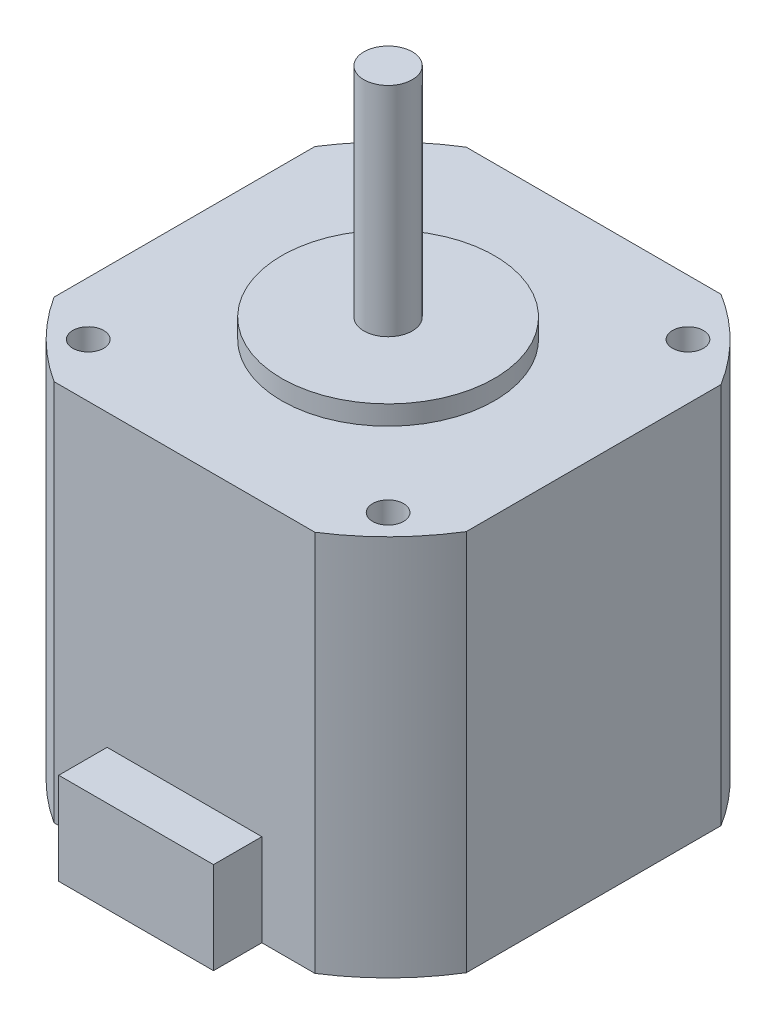
from build123d import *

# Parameters (mm, degrees)
EXTRUDE_1_DEPTH     = 39.5
SKETCH_2_R          = 11
EXTRUDE_2_DEPTH     = 2
SKETCH_3_R          = 2.5
EXTRUDE_3_DEPTH     = 22.5
SKETCH_4_W          = 16
SKETCH_4_H          = 5
EXTRUDE_4_DEPTH     = 9.5
SKETCH_5_R          = 1.6
CUT_EXTRUDE_1_DEPTH = 5


with BuildPart() as part:
    # 草图1 → 凸台-拉伸1 (new body)
    with BuildSketch(Plane(origin=(0, 0, 0), x_dir=(1, 0, 0), z_dir=(0, 1, 0))):
        with BuildLine():
            ThreePointArc((0, 7.563061875), (3.37233047, 3.37233047), (7.563061875, 0))
            Line((7.563061875, 0), (34.536938125, 0))
            ThreePointArc((34.536938125, 0), (38.859801315, 3.505457341), (42.3, 7.880432809))
            Line((42.3, 7.880432809), (42.3, 34.219567191))
            ThreePointArc((42.3, 34.219567191), (38.72766953, 38.72766953), (34.219567191, 42.3))
            Line((34.219567191, 42.3), (7.880432809, 42.3))
            ThreePointArc((7.880432809, 42.3), (3.505457341, 38.859801315), (0, 34.536938125))
            Line((0, 34.536938125), (0, 7.563061875))
        make_face()
    extrude(amount=EXTRUDE_1_DEPTH)

    # 草图2 → 凸台-拉伸2 (add)
    with BuildSketch(Plane(origin=(0, 39.5, 0), x_dir=(1, 0, 0), z_dir=(0, 1, 0))):
        with Locations(Location((21.05, 21.05, 0), (0, 0, 270))):
            Circle(SKETCH_2_R)
    extrude(amount=EXTRUDE_2_DEPTH)

    # 草图3 → 凸台-拉伸3 (add)
    with BuildSketch(Plane(origin=(0, 41.5, 0), x_dir=(1, 0, 0), z_dir=(0, 1, 0))):
        with Locations(Location((21.05, 21.05, 0), (0, 0, 90))):
            Circle(SKETCH_3_R)
    extrude(amount=EXTRUDE_3_DEPTH)

    # 草图4 → 凸台-拉伸4 (add)
    with BuildSketch(Plane(origin=(0, 0, 0), x_dir=(1, 0, 0), z_dir=(0, 1, 0))):
        with Locations((21.05, -2.5)):
            Rectangle(SKETCH_4_W, SKETCH_4_H)
    extrude(amount=EXTRUDE_4_DEPTH)

    # 草图5 → 切除-拉伸1 (cut)
    with BuildSketch(Plane(origin=(0, 39.5, 0), x_dir=(1, 0, 0), z_dir=(0, 1, 0))):
        with Locations(Location((5.55, 36.55, 0), (0, 0, 270))):
            Circle(SKETCH_5_R)
        with Locations(Location((36.55, 36.55, 0), (0, 0, 90))):
            Circle(SKETCH_5_R)
        with Locations(Location((36.55, 5.55, 0), (0, 0, 270))):
            Circle(SKETCH_5_R)
        with Locations(Location((5.55, 5.55, 0), (0, 0, 90))):
            Circle(SKETCH_5_R)
    extrude(amount=-CUT_EXTRUDE_1_DEPTH, mode=Mode.SUBTRACT)


solid = part.part
